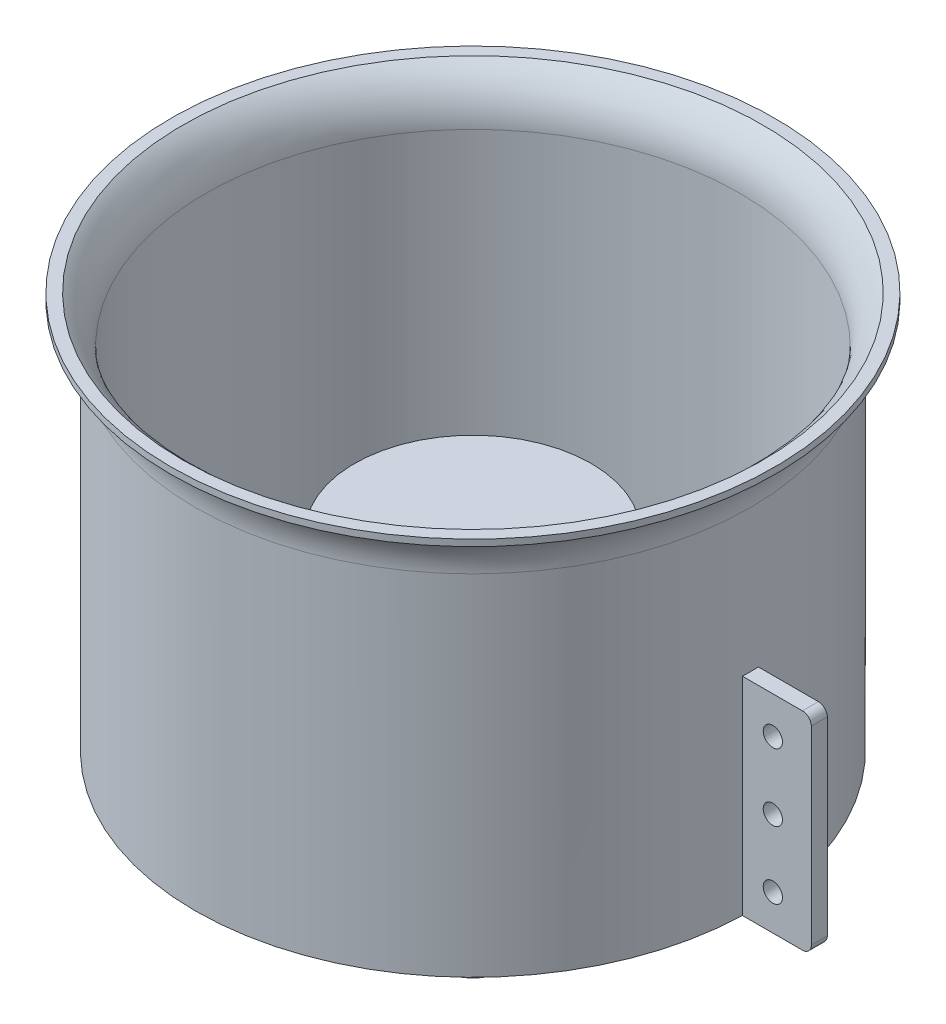
from build123d import *

# Parameters (mm, degrees)
SKETCH2_R                = 20
BOSS_EXTRUDE1_DEPTH      = 32
SKETCH3_R                = 17.5
BOSS_EXTRUDE2_DEPTH      = 20
SKETCH4_R                = 6
BOSS_EXTRUDE3_DEPTH      = 9
SKETCH5_W                = 13.425
SKETCH5_H                = 35
BOSS_EXTRUDE4_DEPTH      = 1.35
SKETCH6_R                = 1.625
CUT_EXTRUDE1_DEPTH       = 104.207424636
FILLET1_R                = 1.5
CIRPATTERN1_COUNT        = 2
FILLET1_OF_CIRPATTERN1_R = 1.5


with BuildPart() as part:
    # Sketch1 → Revolve1 (revolve)
    with BuildSketch(Plane.XY):
        with BuildLine():
            Line((-45.075, 0), (-45.075, 59))
            ThreePointArc((-45.075, 59), (-46.109109283, 63.455491696), (-49, 67))
            Line((-49, 67), (-51, 67))
            Line((-51, 67), (-51, 65.9))
            Line((-51, 65.9), (-49.5, 65.9))
            ThreePointArc((-49.5, 65.9), (-47.553417784, 62.69122693), (-46.875, 59))
            Line((-46.875, 59), (-46.875, 0))
            Line((-46.875, 0), (-45.075, 0))
        make_face()
    revolve(axis=Axis((0, 55, 0), (0, -1, 0)))

    # Sketch5 → Boss-Extrude4 (add, symmetric)
    with BuildSketch(Plane.XY):
        with Locations((-51.7875, 17.5)):
            Rectangle(SKETCH5_W, SKETCH5_H)
    boss_extrude4 = extrude(amount=BOSS_EXTRUDE4_DEPTH, both=True)

    # Sketch6 → Cut-Extrude1 (cut, through all)
    with BuildSketch(Plane.XY.offset(1.35)):
        with Locations((-52, 6)):
            Circle(SKETCH6_R)
        with Locations((-52, 17.375)):
            Circle(SKETCH6_R)
        with Locations((-52, 28.75)):
            Circle(SKETCH6_R)
    cut_extrude1 = extrude(amount=-CUT_EXTRUDE1_DEPTH, mode=Mode.SUBTRACT)

    # Fillet1
    fillet1_edges = [part.edges().sort_by_distance(p)[0] for p in [
        (-58.5, 35, 0),
        (-58.5, 0, 0),
    ]]
    fillet(fillet1_edges, radius=FILLET1_R)

    # CirPattern1: Boss-Extrude4, Cut-Extrude1 ×2 about axis
    cirpattern1_axis = Axis((0, 55, 0), (0, -1, 0))
    add([boss_extrude4.rotate(cirpattern1_axis, i * 360 / CIRPATTERN1_COUNT) for i in range(1, CIRPATTERN1_COUNT)])
    add([cut_extrude1.rotate(cirpattern1_axis, i * 360 / CIRPATTERN1_COUNT) for i in range(1, CIRPATTERN1_COUNT)], mode=Mode.SUBTRACT)

    # Fillet1 of CirPattern1
    fillet1_of_cirpattern1_edges = [part.edges().sort_by_distance(p)[0] for p in [
        (58.5, 35, 0),
        (58.5, 0, 0),
    ]]
    fillet(fillet1_of_cirpattern1_edges, radius=FILLET1_OF_CIRPATTERN1_R)


with BuildPart() as body_2:
    # Sketch2 → Boss-Extrude1 (new body)
    with BuildSketch(Plane.XZ):
        Circle(SKETCH2_R)
    extrude(amount=-BOSS_EXTRUDE1_DEPTH)

    # Sketch3 → Boss-Extrude2 (add)
    with BuildSketch(Plane.XZ):
        Circle(SKETCH3_R)
    extrude(amount=BOSS_EXTRUDE2_DEPTH)

    # Sketch4 → Boss-Extrude3 (add)
    with BuildSketch(Plane.XZ.offset(20)):
        Circle(SKETCH4_R)
    extrude(amount=BOSS_EXTRUDE3_DEPTH)


solid = Compound([part.part, body_2.part])
